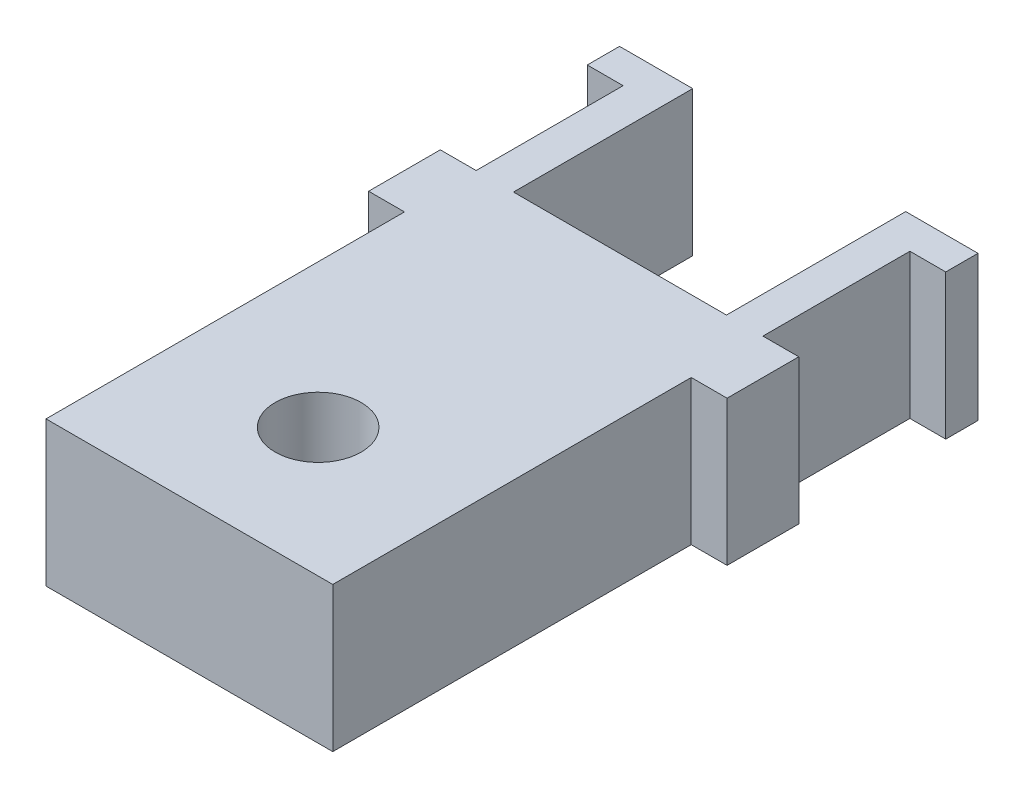
from build123d import *

# Parameters (mm, degrees)
SKETCH1_R           = 1.524
BOSS_EXTRUDE2_DEPTH = 5.1308


with BuildPart() as part:
    # Sketch1 → Boss-Extrude2 (new body)
    with BuildSketch(Plane(origin=(0, 0, 0), x_dir=(1, 0, 0), z_dir=(0, 1, 0))):
        Polygon((3.789110208, 7.62), (3.789110208, 13.97), (6.35, 13.97), (6.35, 12.827), (5.08, 12.827), (5.08, 7.62), (6.35, 7.62), (6.35, 5.08), (5.08, 5.08), (5.08, -7.62), (-5.08, -7.62), (-5.08, 5.08), (-6.35, 5.08), (-6.35, 7.62), (-5.08, 7.62), (-5.08, 12.827), (-6.35, 12.827), (-6.35, 13.97), (-3.757831609, 13.97), (-3.757831609, 7.62), align=None)
        with Locations((0, -3.057558155)):
            Circle(SKETCH1_R, mode=Mode.SUBTRACT)
    extrude(amount=BOSS_EXTRUDE2_DEPTH)


solid = part.part
